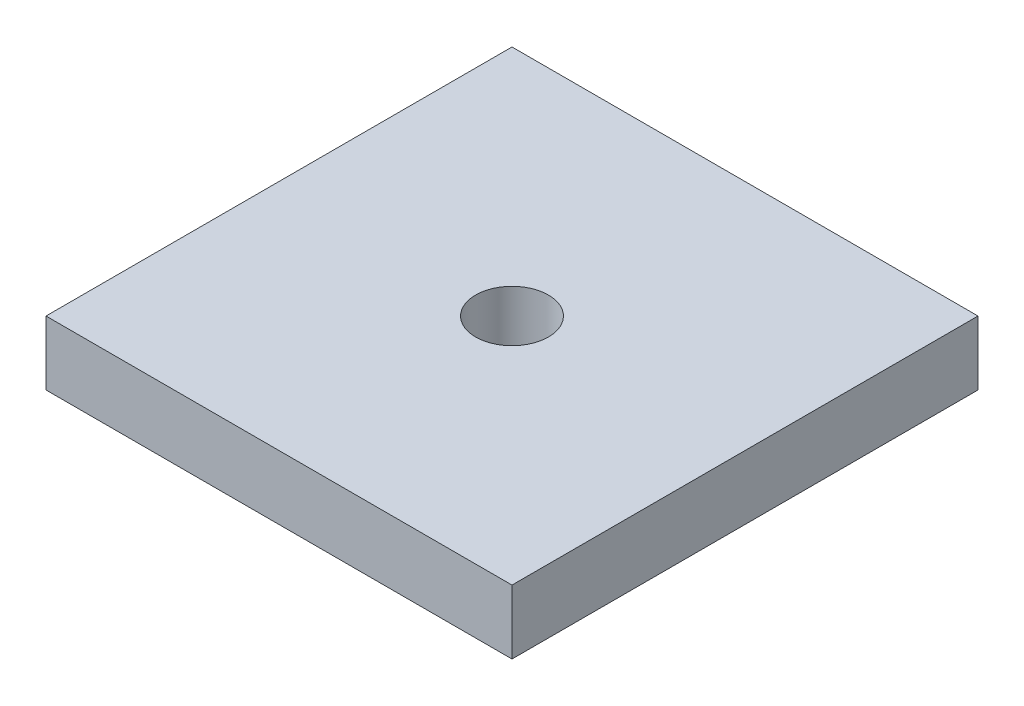
from build123d import *

# Parameters (mm, degrees)
SKETCH1_W           = 16
SKETCH1_H           = 16
SKETCH1_R           = 1.25
BOSS_EXTRUDE1_DEPTH = 2.2


with BuildPart() as part:
    # Sketch1 → Boss-Extrude1 (new body)
    with BuildSketch(Plane(origin=(0, 0, 0), x_dir=(1, 0, 0), z_dir=(0, 1, 0))):
        with Locations((8, 8)):
            Rectangle(SKETCH1_W, SKETCH1_H)
        with Locations(Location((8, 8, 0), (0, 0, 270))):
            Circle(SKETCH1_R, mode=Mode.SUBTRACT)
    extrude(amount=BOSS_EXTRUDE1_DEPTH)


solid = part.part
